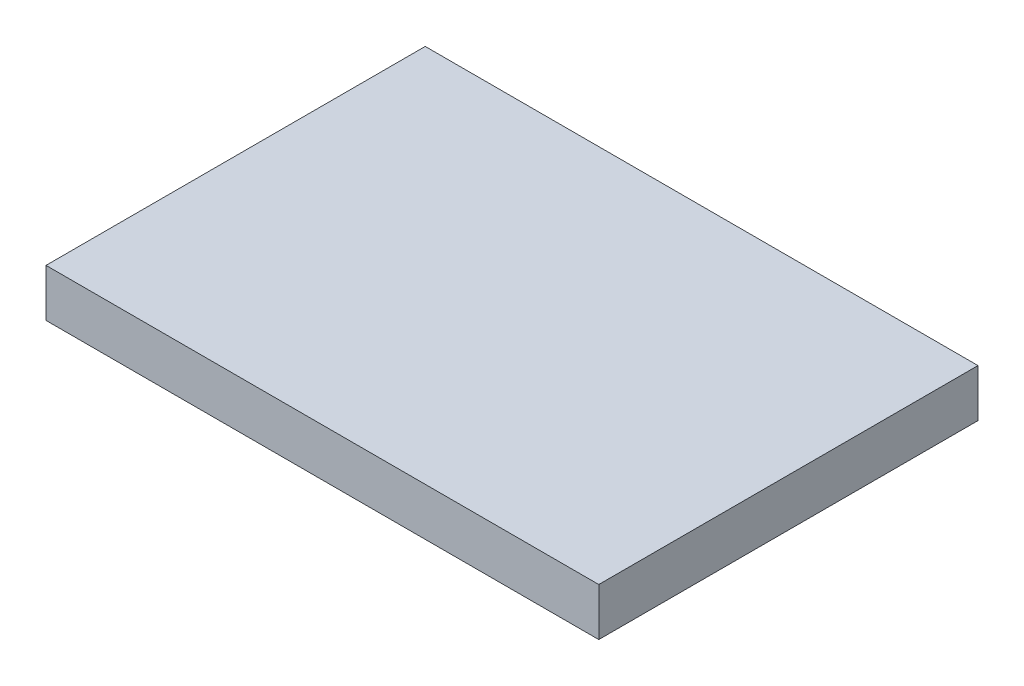
from build123d import *

# Parameters (mm, degrees)
SKETCH6_W      = 147.191865544
SKETCH6_H      = 100.979479207
EXTRUDE1_DEPTH = 12.7


with BuildPart() as part:
    # Sketch6 → Extrude1 (new body)
    with BuildSketch(Plane(origin=(0, 0, 0), x_dir=(1, 0, 0), z_dir=(0, 1, 0))):
        with Locations((73.595932772, 50.489739604)):
            Rectangle(SKETCH6_W, SKETCH6_H)
    extrude(amount=EXTRUDE1_DEPTH)


solid = part.part
